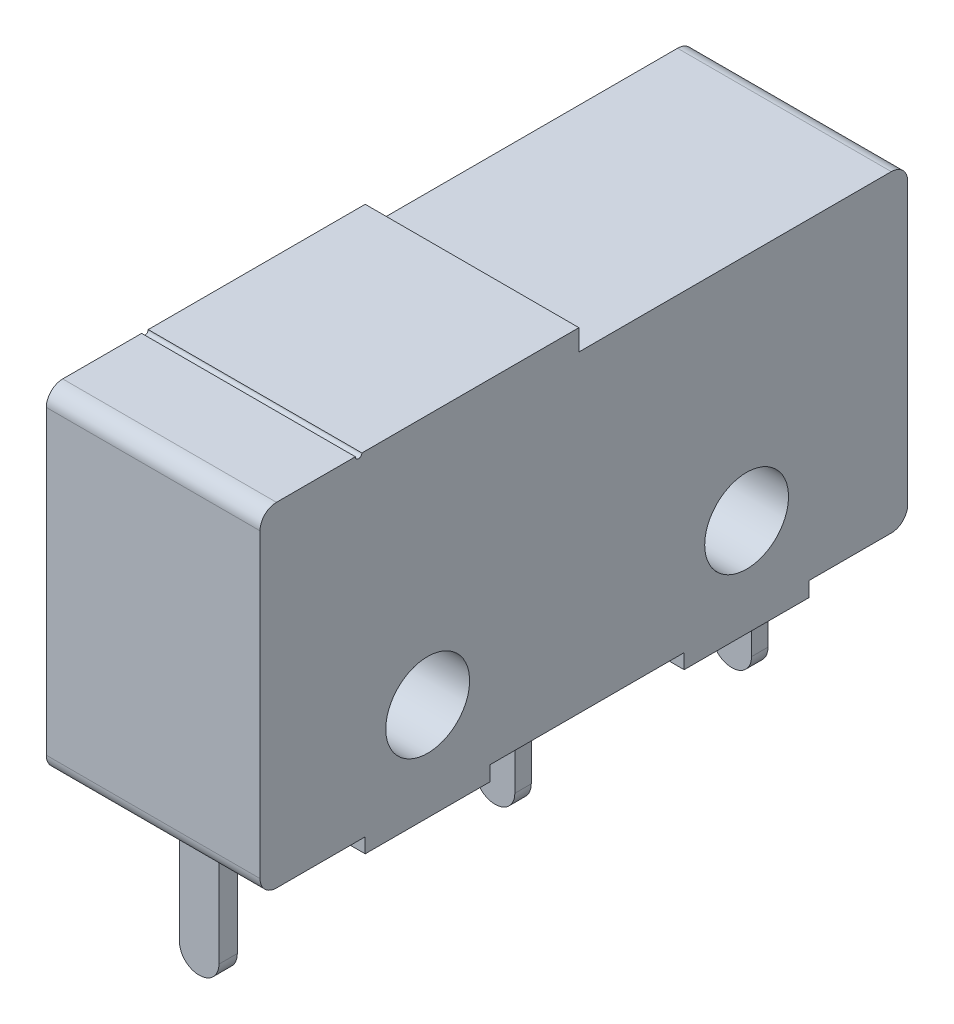
from build123d import *

# Parameters (mm, degrees)
SKETCH1_R             = 1.275
BOSS_EXTRUDE1_DEPTH   = 6.5
SKETCH3_W             = 3.2
SKETCH3_H             = 0.56
SKETCH3_H_2           = 0.5
BOSS_EXTRUDE3_DEPTH   = 0.9
SKETCH4_W             = 1.2
SKETCH4_H             = 0.56
SKETCH4_H_2           = 0.5
BOSS_EXTRUDE4_DEPTH   = 3.47
FILLET2_R             = 0.59
ESBO_O1_R             = 0.1
CORTE_EXTRUS_O1_DEPTH = 40.747314551


with BuildPart() as part:
    # Sketch1 → Boss-Extrude1 (new body)
    with BuildSketch(Plane(origin=(0, 0, 0), x_dir=(0, 0, -1), z_dir=(1, 0, 0))):
        with BuildLine():
            Line((-37.373122581, 0), (-34.673122581, 0))
            Line((-34.673122581, 0), (-34.673122581, -0.45))
            Line((-34.673122581, -0.45), (-30.873122581, -0.45))
            Line((-30.873122581, -0.45), (-30.873122581, 0))
            Line((-30.873122581, 0), (-24.973122581, 0))
            Line((-24.973122581, 0), (-24.973122581, -0.45))
            Line((-24.973122581, -0.45), (-21.173122581, -0.45))
            Line((-21.173122581, -0.45), (-21.173122581, 0))
            Line((-21.173122581, 0), (-18.673122581, 0))
            ThreePointArc((-18.673122581, 0), (-18.31956919, 0.146446609), (-18.173122581, 0.5))
            Line((-18.173122581, 0.5), (-18.173122581, 9.02))
            ThreePointArc((-18.173122581, 9.02), (-18.31956919, 9.373553391), (-18.673122581, 9.52))
            Line((-18.673122581, 9.52), (-28.173122581, 9.52))
            Line((-28.173122581, 9.52), (-28.173122581, 10.16))
            Line((-28.173122581, 10.16), (-37.373122581, 10.16))
            ThreePointArc((-37.373122581, 10.16), (-37.726675972, 10.013553391), (-37.873122581, 9.66))
            Line((-37.873122581, 9.66), (-37.873122581, 0.5))
            ThreePointArc((-37.873122581, 0.5), (-37.726675972, 0.146446609), (-37.373122581, 0))
        make_face()
        with Locations(Location((-32.773122581, 2.525, 0), (0, 0, 180))):
            Circle(SKETCH1_R, mode=Mode.SUBTRACT)
        with Locations(Location((-23.073122581, 2.525, 0), (0, 0, 180))):
            Circle(SKETCH1_R, mode=Mode.SUBTRACT)
    extrude(amount=BOSS_EXTRUDE1_DEPTH)

    # Sketch3 → Boss-Extrude3 (add)
    with BuildSketch(Plane(origin=(0, 0, 0), x_dir=(-1, 0, 0), z_dir=(0, -1, 0))):
        with Locations((-3.25, -36.193122581)):
            Rectangle(SKETCH3_W, SKETCH3_H)
        with Locations((-3.25, -27.223122581)):
            Rectangle(SKETCH3_W, SKETCH3_H_2)
        with Locations((-3.25, -20.023122581)):
            Rectangle(SKETCH3_W, SKETCH3_H_2)
    extrude(amount=BOSS_EXTRUDE3_DEPTH)

    # Sketch4 → Boss-Extrude4 (add)
    with BuildSketch(Plane(origin=(0, -0.9, 0), x_dir=(-1, 0, 0), z_dir=(0, -1, 0))):
        with Locations((-3.25, -36.193122581)):
            Rectangle(SKETCH4_W, SKETCH4_H)
        with Locations((-3.25, -27.223122581)):
            Rectangle(SKETCH4_W, SKETCH4_H_2)
        with Locations((-3.25, -20.023122581)):
            Rectangle(SKETCH4_W, SKETCH4_H_2)
    extrude(amount=BOSS_EXTRUDE4_DEPTH)

    # Fillet2
    fillet2_edges = [part.edges().sort_by_distance(p)[0] for p in [
        (2.65, -4.37, 36.193122581),
        (3.85, -4.37, 36.193122581),
        (2.65, -4.37, 27.223122581),
        (3.85, -4.37, 27.223122581),
        (3.85, -4.37, 20.023122581),
        (2.65, -4.37, 20.023122581),
    ]]
    fillet(fillet2_edges, radius=FILLET2_R)

    # Esboço1 → Corte-extrusão1 (cut, through all)
    with BuildSketch(Plane.ZY):
        with Locations((34.873122581, 10.16)):
            Circle(ESBO_O1_R)
    extrude(amount=-CORTE_EXTRUS_O1_DEPTH, mode=Mode.SUBTRACT)


solid = part.part
